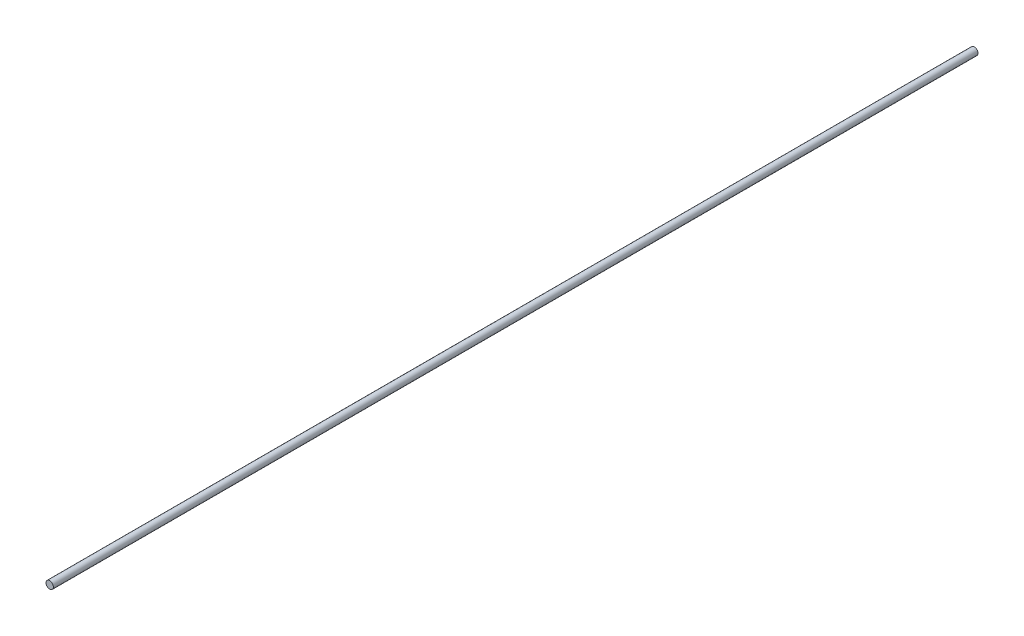
from build123d import *

# Parameters (mm, degrees)
SKETCH1_R           = 4
BOSS_EXTRUDE1_DEPTH = 1000


with BuildPart() as part:
    # Sketch1 → Boss-Extrude1 (new body)
    with BuildSketch(Plane.XY):
        with Locations((65, 0)):
            Circle(SKETCH1_R)
    extrude(amount=-BOSS_EXTRUDE1_DEPTH)


solid = part.part
